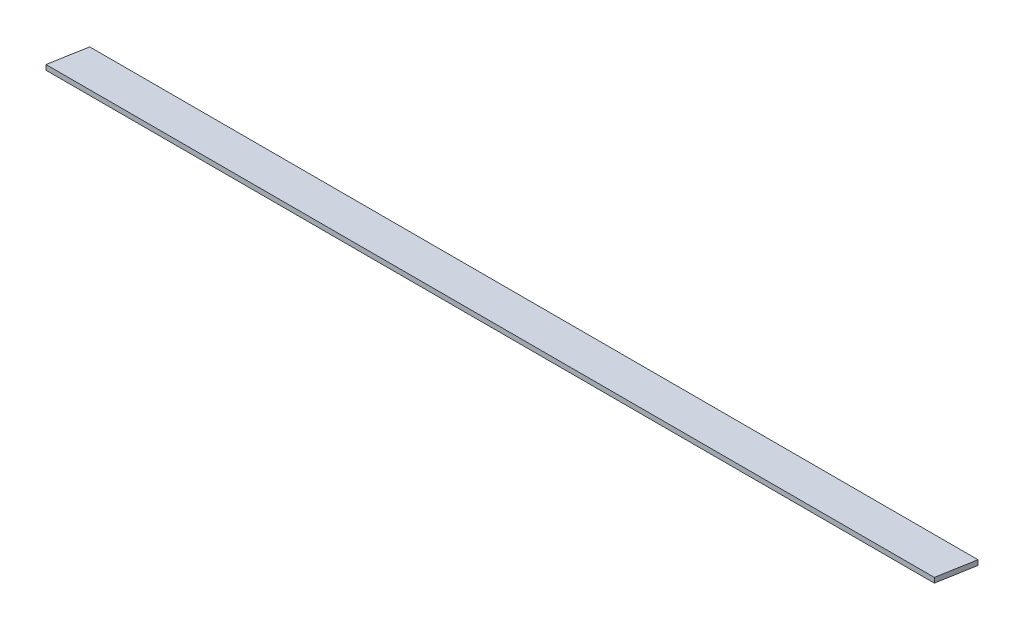
from build123d import *

# Parameters (mm, degrees)
SKETCH1_W           = 2286
SKETCH1_H           = 88.9
BOSS_EXTRUDE1_DEPTH = 5.953125
CUT_EXTRUDE1_DEPTH  = 1144.925942222


with BuildPart() as part:
    # Sketch1 → Boss-Extrude1 (new, symmetric)
    with BuildSketch(Plane(origin=(0, 0, 0), x_dir=(1, 0, 0), z_dir=(0, 1, 0))):
        Rectangle(SKETCH1_W, SKETCH1_H)
    extrude(amount=BOSS_EXTRUDE1_DEPTH, both=True)

    # Sketch4 → Cut-Extrude1 (cut, through all)
    with BuildSketch(Plane(origin=(0, 5.953125, 0), x_dir=(1, 0, 0), z_dir=(0, 1, 0))):
        Polygon((-1035.249531415, 44.45), (-1050.925, -44.45), (-1143, -44.45), (-1143, 44.45), align=None)
        Polygon((1090.412968585, 44.45), (1074.7375, -44.45), (1143, -44.45), (1143, 44.45), align=None)
    extrude(amount=-CUT_EXTRUDE1_DEPTH, mode=Mode.SUBTRACT)


solid = part.part
